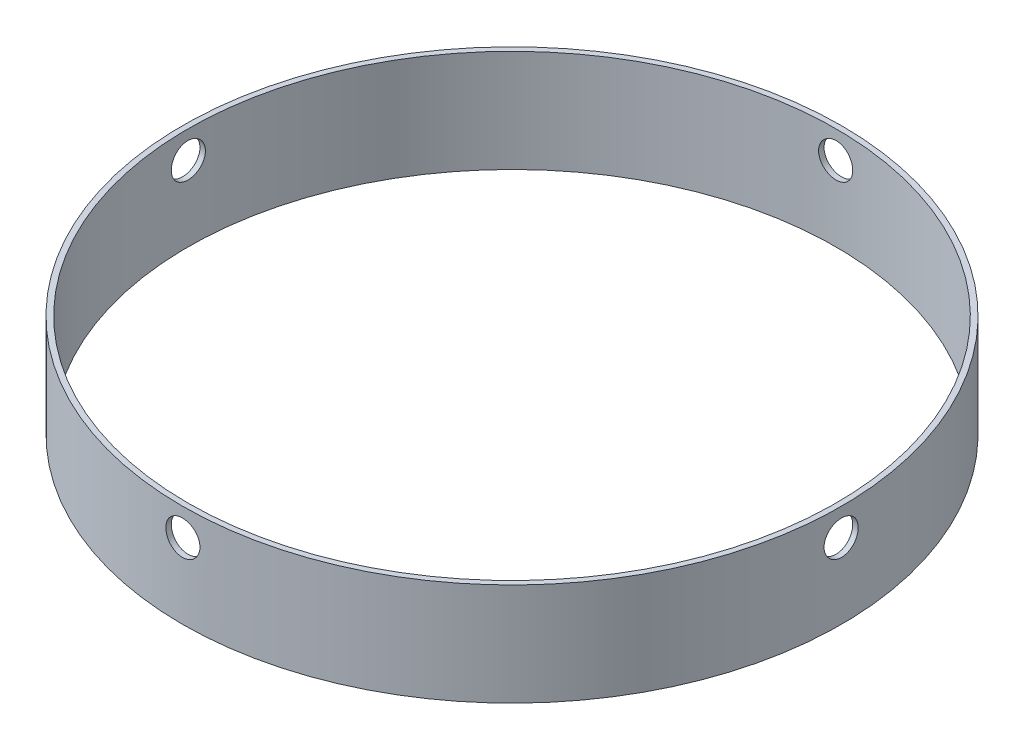
from build123d import *

# Parameters (mm, degrees)
SKETCH1_R               = 48.3
SKETCH1_R_2             = 47.5
BOSS_EXTRUDE1_DEPTH     = 15
CUT_EXTRUDE1_DEPTH      = 70.934111848
CUT_EXTRUDE1_DEPTH_BACK = 70.934111848
SKETCH2_R               = 2.5
CUT_EXTRUDE2_DEPTH      = 70.934112022
CUT_EXTRUDE2_DEPTH_BACK = 70.934112022
SKETCH3_R               = 2.5


with BuildPart() as part:
    # Sketch1 → Boss-Extrude1 (new body)
    with BuildSketch(Plane(origin=(0, 0, 0), x_dir=(1, 0, 0), z_dir=(0, 1, 0))):
        with Locations(Location((0, 0, 0), (0, 0, 270))):
            Circle(SKETCH1_R)
        with Locations(Location((0, 0, 0), (0, 0, 270))):
            Circle(SKETCH1_R_2, mode=Mode.SUBTRACT)
    extrude(amount=BOSS_EXTRUDE1_DEPTH)

    # Sketch2 → Cut-Extrude1 (cut, two sides: drawn at the far end of the back side and taken through both)
    with BuildSketch(Plane.XY.offset(-CUT_EXTRUDE1_DEPTH_BACK)):
        with Locations((0, 11)):
            Circle(SKETCH2_R)
    extrude(amount=CUT_EXTRUDE1_DEPTH + CUT_EXTRUDE1_DEPTH_BACK, mode=Mode.SUBTRACT)

    # Sketch3 → Cut-Extrude2 (cut, two sides: drawn at the far end of the back side and taken through both)
    with BuildSketch(Plane(origin=(0, 0, 0), x_dir=(0, 0, -1), z_dir=(1, 0, 0)).offset(-CUT_EXTRUDE2_DEPTH_BACK)):
        with Locations((0, 11)):
            Circle(SKETCH3_R)
    extrude(amount=CUT_EXTRUDE2_DEPTH + CUT_EXTRUDE2_DEPTH_BACK, mode=Mode.SUBTRACT)


solid = part.part
